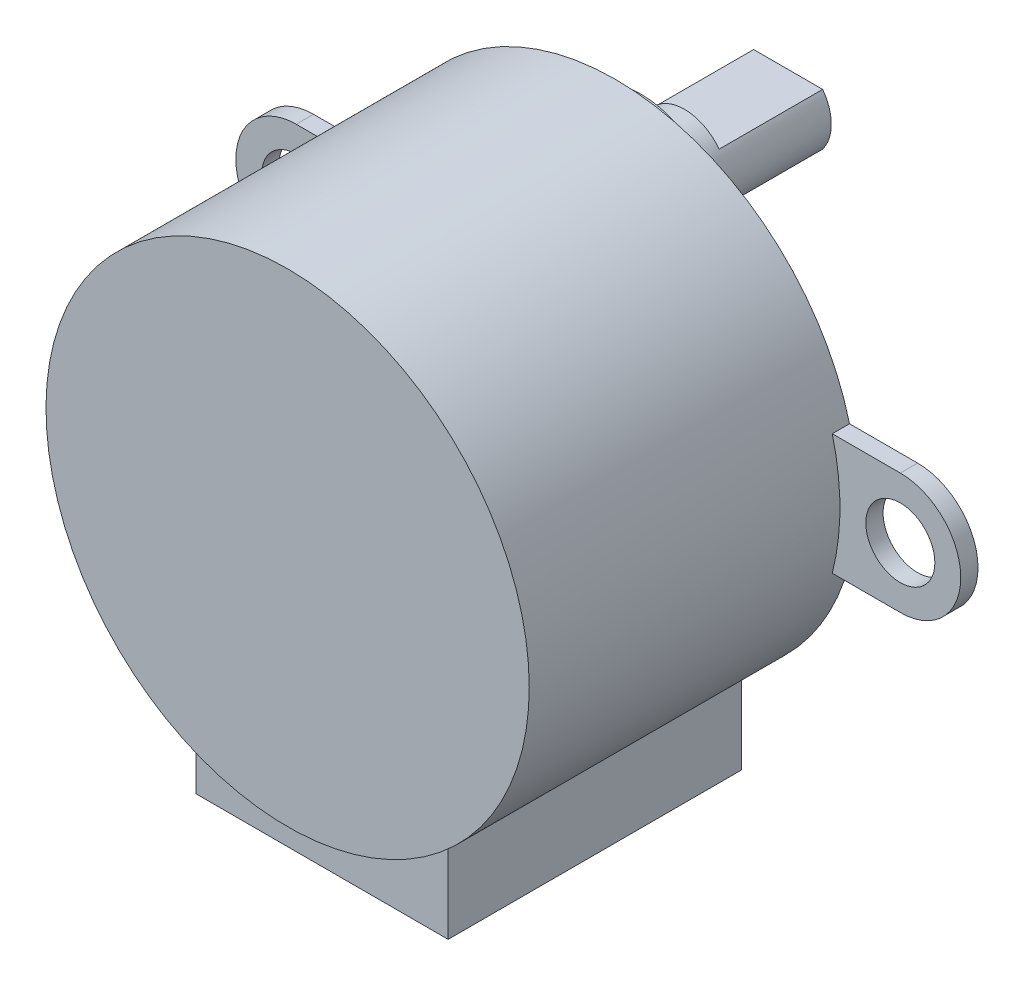
from build123d import *

# Parameters (mm, degrees)
SKETCH1_R               = 2
BOSS_EXTRUDE1_DEPTH     = 1
BOSS_EXTRUDE2_DEPTH     = 18
CUT_EXTRUDE1_DEPTH      = 34.03028913
CUT_EXTRUDE1_DEPTH_BACK = 2
SKETCH4_R               = 4.5
BOSS_EXTRUDE3_DEPTH     = 1.5
SKETCH5_R               = 2.5
BOSS_EXTRUDE4_DEPTH     = 8.5
CUT_EXTRUDE2_START      = -6
CUT_EXTRUDE2_DEPTH      = 6


with BuildPart() as part:
    # Sketch1 → Boss-Extrude1 (new body)
    with BuildSketch(Plane.XY):
        with BuildLine():
            Line((-17.5, 3.5), (-13.555441712, 3.5))
            ThreePointArc((-13.555441712, 3.5), (0, 14), (13.555441712, 3.5))
            Line((13.555441712, 3.5), (17.5, 3.5))
            ThreePointArc((17.5, 3.5), (21, 0), (17.5, -3.5))
            Line((17.5, -3.5), (13.555441712, -3.5))
            ThreePointArc((13.555441712, -3.5), (11.250406053, -8.332368429), (7.3, -11.94612908))
            Line((7.3, -11.94612908), (7.3, -17))
            Line((7.3, -17), (-7.3, -17))
            Line((-7.3, -17), (-7.3, -11.94612908))
            ThreePointArc((-7.3, -11.94612908), (-11.250406053, -8.332368429), (-13.555441712, -3.5))
            Line((-13.555441712, -3.5), (-17.5, -3.5))
            ThreePointArc((-17.5, -3.5), (-21, 0), (-17.5, 3.5))
        make_face()
        with Locations((17.5, 0)):
            Circle(SKETCH1_R, mode=Mode.SUBTRACT)
        with Locations((-17.5, 0)):
            Circle(SKETCH1_R, mode=Mode.SUBTRACT)
    extrude(amount=BOSS_EXTRUDE1_DEPTH)

    # Sketch2 → Boss-Extrude2 (add)
    with BuildSketch(Plane.XY.offset(1)):
        with BuildLine():
            Line((-7.3, -11.94612908), (-7.3, -17))
            Line((-7.3, -17), (7.3, -17))
            Line((7.3, -17), (7.3, -11.94612908))
            ThreePointArc((7.3, -11.94612908), (11.250406053, -8.332368429), (13.555441712, -3.5))
            ThreePointArc((13.555441712, -3.5), (14, 0), (13.555441712, 3.5))
            ThreePointArc((13.555441712, 3.5), (0, 14), (-13.555441712, 3.5))
            ThreePointArc((-13.555441712, 3.5), (-14, 0), (-13.555441712, -3.5))
            ThreePointArc((-13.555441712, -3.5), (-11.250406053, -8.332368429), (-7.3, -11.94612908))
        make_face()
    extrude(amount=BOSS_EXTRUDE2_DEPTH)

    # Sketch3 → Cut-Extrude1 (cut, two sides: drawn at the far end of the back side and taken through both)
    with BuildSketch(Plane.XY.offset(19).offset(-CUT_EXTRUDE1_DEPTH_BACK)):
        with BuildLine():
            Line((7.3, -17), (7.3, -11.94612908))
            ThreePointArc((7.3, -11.94612908), (0, -14), (-7.3, -11.94612908))
            Line((-7.3, -11.94612908), (-7.3, -17))
            Line((-7.3, -17), (7.3, -17))
        make_face()
    extrude(amount=CUT_EXTRUDE1_DEPTH + CUT_EXTRUDE1_DEPTH_BACK, mode=Mode.SUBTRACT)

    # Sketch4 → Boss-Extrude3 (add)
    with BuildSketch(Plane(origin=(0, 0, 0), x_dir=(-1, 0, 0), z_dir=(0, 0, -1))):
        with Locations(Location((0, 8, 0), (0, 0, 180))):
            Circle(SKETCH4_R)
    extrude(amount=BOSS_EXTRUDE3_DEPTH)

    # Sketch5 → Boss-Extrude4 (add)
    with BuildSketch(Plane(origin=(0, 0, -1.5), x_dir=(-1, 0, 0), z_dir=(0, 0, -1))):
        with Locations((0, 8)):
            Circle(SKETCH5_R)
    extrude(amount=BOSS_EXTRUDE4_DEPTH)

    # Sketch6 → Cut-Extrude2 (cut)
    with BuildSketch(Plane(origin=(0, 0, -10), x_dir=(-1, 0, 0), z_dir=(0, 0, -1)).offset(CUT_EXTRUDE2_START)):
        with BuildLine():
            Line((-2, 9.5), (2, 9.5))
            ThreePointArc((2, 9.5), (0, 10.5), (-2, 9.5))
        make_face()
        with BuildLine():
            Line((-2, 6.5), (2, 6.5))
            ThreePointArc((2, 6.5), (0, 5.5), (-2, 6.5))
        make_face()
    extrude(amount=CUT_EXTRUDE2_DEPTH, mode=Mode.SUBTRACT)


solid = part.part
